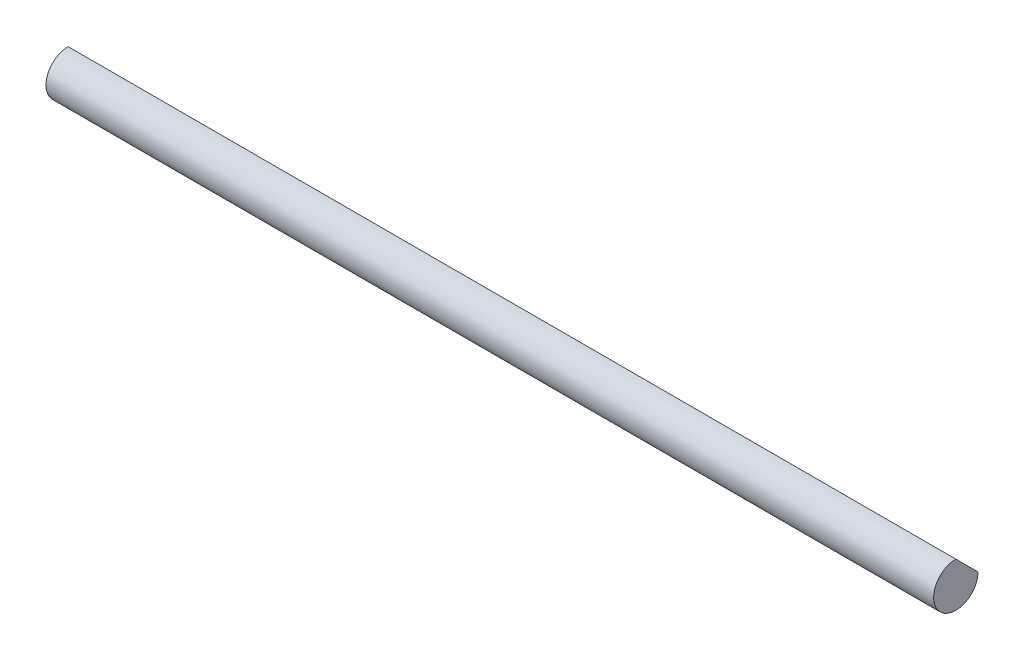
from build123d import *

# Parameters (mm, degrees)
BOSS_EXTRUDE1_DEPTH = 127


with BuildPart() as part:
    # Sketch1 → Boss-Extrude1 (new body)
    with BuildSketch(Plane(origin=(0, 0, 0), x_dir=(0, 0, -1), z_dir=(1, 0, 0))):
        with BuildLine():
            Line((0, 3.175), (3.175, 0))
            ThreePointArc((3.175, 0), (-2.24506403, -2.24506403), (0, 3.175))
        make_face()
    extrude(amount=BOSS_EXTRUDE1_DEPTH)


solid = part.part
